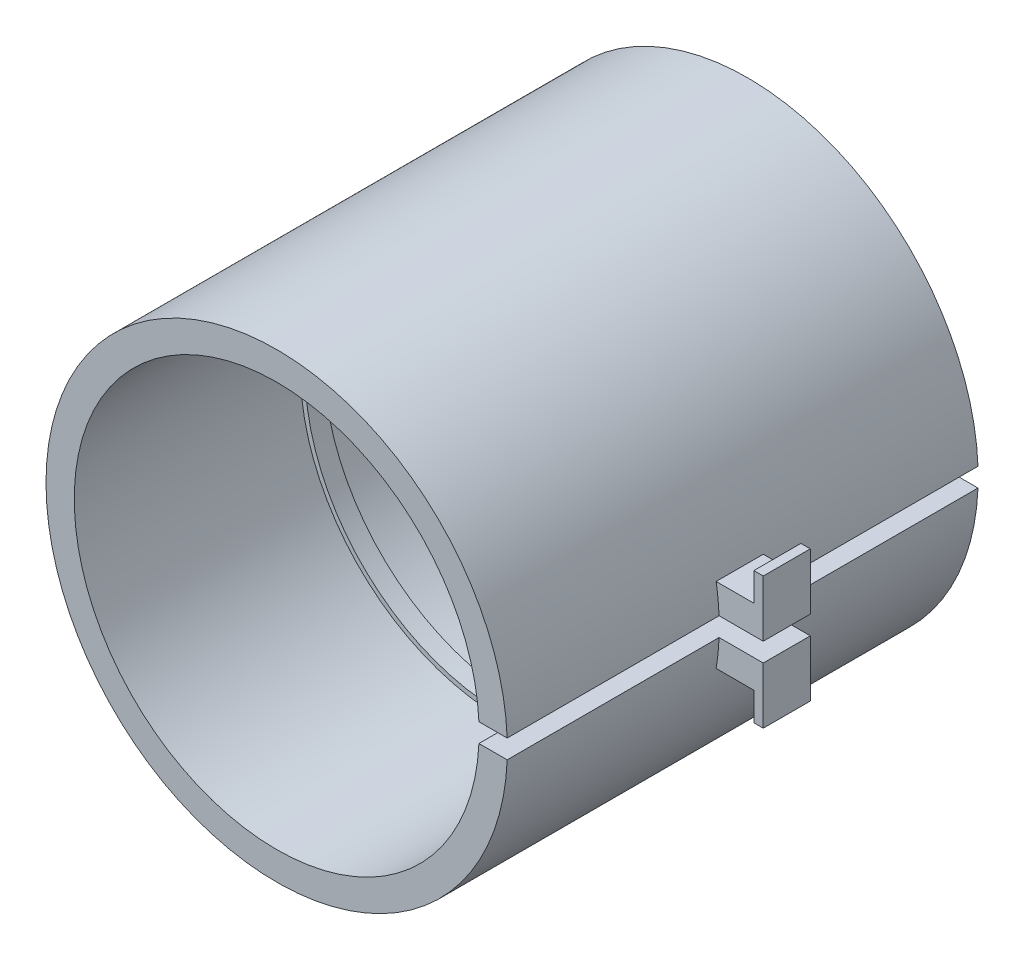
from build123d import *

# Parameters (mm, degrees)
BOSS_EXTRUDE1_DEPTH = 50
BOSS_EXTRUDE2_DEPTH = 2.5
BOSS_EXTRUDE3_DEPTH = 1
SKETCH4_W           = 1
SKETCH4_H           = 5
BOSS_EXTRUDE4_DEPTH = 3


with BuildPart() as part:
    # Sketch1 → Boss-Extrude1 (new body)
    with BuildSketch(Plane.XY):
        with BuildLine():
            Line((21.476731595, 1), (24.47958333, 1))
            ThreePointArc((24.47958333, 1), (-24.5, 0), (24.47958333, -1))
            Line((24.47958333, -1), (21.476731595, -1))
            ThreePointArc((21.476731595, -1), (-21.5, 0), (21.476731595, 1))
        make_face()
    extrude(amount=BOSS_EXTRUDE1_DEPTH)

    # Sketch2 → Boss-Extrude2 (add, symmetric)
    with BuildSketch(Plane.XY.offset(25)):
        with BuildLine():
            Line((24.47958333, 1), (29.171263931, 1))
            Line((29.171263931, 1), (29.171263931, 4))
            Line((29.171263931, 4), (24.171263931, 4))
            ThreePointArc((24.171263931, 4), (24.37162766, 2.504748533), (24.47958333, 1))
        make_face()
        with BuildLine():
            Line((29.171263931, -4), (24.171263931, -4))
            ThreePointArc((24.171263931, -4), (24.37162766, -2.504748533), (24.47958333, -1))
            Line((24.47958333, -1), (29.171263931, -1))
            Line((29.171263931, -1), (29.171263931, -4))
        make_face()
    extrude(amount=BOSS_EXTRUDE2_DEPTH, both=True)

    # Sketch3 → Boss-Extrude3 (add, symmetric)
    with BuildSketch(Plane.XY.offset(25)):
        with BuildLine():
            Line((20.976176963, 1), (21.476731595, 1))
            ThreePointArc((21.476731595, 1), (-21.5, 0), (21.476731595, -1))
            Line((21.476731595, -1), (20.976176963, -1))
            ThreePointArc((20.976176963, -1), (-21, 0), (20.976176963, 1))
        make_face()
    extrude(amount=BOSS_EXTRUDE3_DEPTH, both=True)

    # Sketch4 → Boss-Extrude4 (add)
    with BuildSketch(Plane(origin=(0, 4, 0), x_dir=(1, 0, 0), z_dir=(0, 1, 0))):
        with Locations((28.671263931, -25)):
            Rectangle(SKETCH4_W, SKETCH4_H)
    boss_extrude4 = extrude(amount=BOSS_EXTRUDE4_DEPTH)

    # Mirror1: Boss-Extrude4 across plane
    add(boss_extrude4.mirror(Plane.ZX))


solid = part.part
